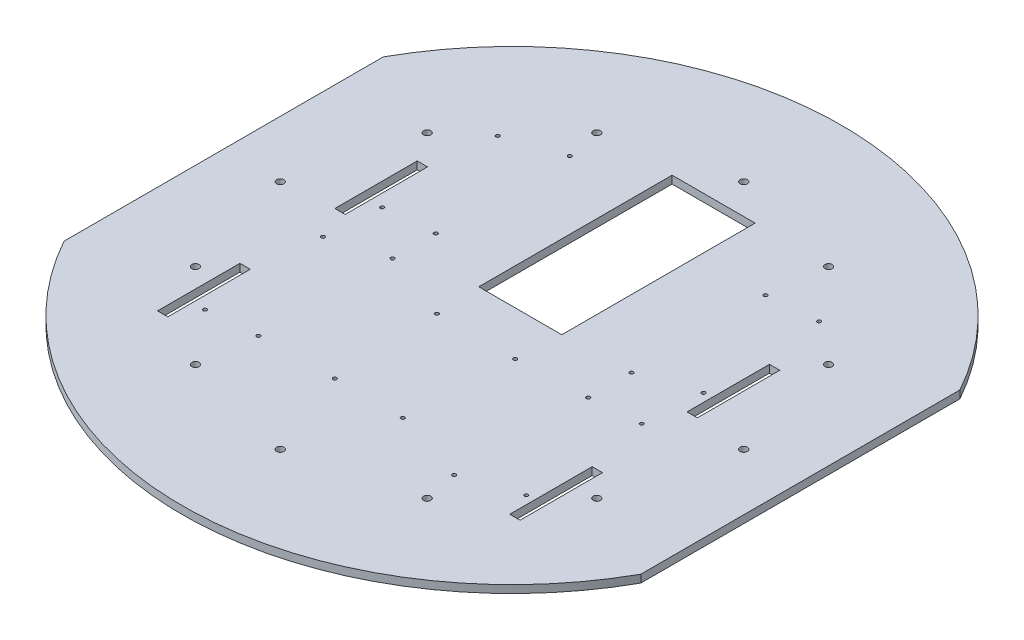
from build123d import *

# Parameters (mm, degrees)
BOSS_EXTRUDE1_DEPTH   = 4.7625
F_8_CLEARANCE_HOLE1_D = 4.4958
CIRPATTERN1_COUNT     = 12
F_4_40_TAPPED_HOLE1_D = 2.2606
CUT_EXTRUDE1_REACH    = 272.048
SKETCH11_W            = 51.189238902
SKETCH11_H            = 119.204570221
CUT_EXTRUDE2_REACH    = 272.048
SKETCH12_W            = 6.35
SKETCH12_H            = 50.8


with BuildPart() as part:
    # Sketch1 → Boss-Extrude1 (new body)
    with BuildSketch(Plane(origin=(0, 0, 0), x_dir=(1, 0, 0), z_dir=(0, 1, 0))):
        with BuildLine():
            Line((177.8, 98.373776994), (177.8, -98.373776994))
            ThreePointArc((177.8, -98.373776994), (0, -203.2), (-177.8, -98.373776994))
            Line((-177.8, -98.373776994), (-177.8, 98.373776994))
            ThreePointArc((-177.8, 98.373776994), (0, 203.2), (177.8, 98.373776994))
        make_face()
    extrude(amount=BOSS_EXTRUDE1_DEPTH)

    # #8 Clearance Hole1 (through all)
    with Locations(Plane(origin=(0, 4.7625, 0), x_dir=(1, 0, 0), z_dir=(0, 1, 0))):
        with Locations((0, -142.875)):
            f_8_clearance_hole1 = Hole(F_8_CLEARANCE_HOLE1_D / 2)

    # CirPattern1: #8 Clearance Hole1 ×12 about axis
    cirpattern1_axis = Axis((0, 0, 0), (0, 1, 0))
    for i in range(1, CIRPATTERN1_COUNT):
        add(f_8_clearance_hole1.rotate(cirpattern1_axis, i * 360 / CIRPATTERN1_COUNT), mode=Mode.SUBTRACT)

    # #4-40 Tapped Hole1 (through all)
    with Locations(Plane(origin=(0, 4.7625, 0), x_dir=(1, 0, 0), z_dir=(0, 1, 0))):
        with Locations((-100.33, 91.5416), (-67.31, 102.9716), (-67.31, 20.32), (-97.79, 17.78), (-100.296230539, -16.186944047), (-67.31, -6.35), (-67.31, -89.0016), (-97.79, -91.5416), (67.31, -102.9716), (100.33, -91.5416), (97.79, -17.78), (67.31, -20.32), (67.31, 6.35), (100.33, 17.78), (97.79, 91.5416), (67.31, 89.0016), (24.13, -22.225), (-24.13, -22.225), (-20.955, -88.265), (20.955, -88.265)):
            Hole(F_4_40_TAPPED_HOLE1_D / 2)

    # Sketch11 → Cut-Extrude1 (cut, up to next)
    with BuildSketch(Plane(origin=(0, 4.7625, 0), x_dir=(1, 0, 0), z_dir=(0, 1, 0)), mode=Mode.PRIVATE) as cut_extrude1_sk1:
        with Locations((0, 64.697510279)):
            Rectangle(SKETCH11_W, SKETCH11_H)
    cut_extrude1_tool1 = extrude(cut_extrude1_sk1.sketch, amount=-CUT_EXTRUDE1_REACH, mode=Mode.PRIVATE) & part.part
    add(cut_extrude1_tool1.solids().sort_by_distance((0, 4.7625, -64.69751))[0], mode=Mode.SUBTRACT)

    # Sketch12 → Cut-Extrude2 (cut, up to next)
    with BuildSketch(Plane(origin=(0, 4.7625, 0), x_dir=(1, 0, 0), z_dir=(0, 1, 0)), mode=Mode.PRIVATE) as cut_extrude2_sk1:
        with Locations((-108.585, 27.94)):
            Rectangle(SKETCH12_W, SKETCH12_H)
    cut_extrude2_tool1 = extrude(cut_extrude2_sk1.sketch, amount=-CUT_EXTRUDE2_REACH, mode=Mode.PRIVATE) & part.part
    # Sketch12 → Cut-Extrude2 (cut, up to next)
    with BuildSketch(Plane(origin=(0, 4.7625, 0), x_dir=(1, 0, 0), z_dir=(0, 1, 0)), mode=Mode.PRIVATE) as cut_extrude2_sk2:
        with Locations((-108.585, -81.3816)):
            Rectangle(SKETCH12_W, SKETCH12_H)
    cut_extrude2_tool2 = extrude(cut_extrude2_sk2.sketch, amount=-CUT_EXTRUDE2_REACH, mode=Mode.PRIVATE) & part.part
    # Sketch12 → Cut-Extrude2 (cut, up to next)
    with BuildSketch(Plane(origin=(0, 4.7625, 0), x_dir=(1, 0, 0), z_dir=(0, 1, 0)), mode=Mode.PRIVATE) as cut_extrude2_sk3:
        with Locations((108.585, 27.94)):
            Rectangle(SKETCH12_W, SKETCH12_H)
    cut_extrude2_tool3 = extrude(cut_extrude2_sk3.sketch, amount=-CUT_EXTRUDE2_REACH, mode=Mode.PRIVATE) & part.part
    # Sketch12 → Cut-Extrude2 (cut, up to next)
    with BuildSketch(Plane(origin=(0, 4.7625, 0), x_dir=(1, 0, 0), z_dir=(0, 1, 0)), mode=Mode.PRIVATE) as cut_extrude2_sk4:
        with Locations((108.585, -81.3816)):
            Rectangle(SKETCH12_W, SKETCH12_H)
    cut_extrude2_tool4 = extrude(cut_extrude2_sk4.sketch, amount=-CUT_EXTRUDE2_REACH, mode=Mode.PRIVATE) & part.part
    add(cut_extrude2_tool1.solids().sort_by_distance((-108.585, 4.7625, -27.94))[0], mode=Mode.SUBTRACT)
    add(cut_extrude2_tool2.solids().sort_by_distance((-108.585, 4.7625, 81.3816))[0], mode=Mode.SUBTRACT)
    add(cut_extrude2_tool3.solids().sort_by_distance((108.585, 4.7625, -27.94))[0], mode=Mode.SUBTRACT)
    add(cut_extrude2_tool4.solids().sort_by_distance((108.585, 4.7625, 81.3816))[0], mode=Mode.SUBTRACT)


solid = part.part
